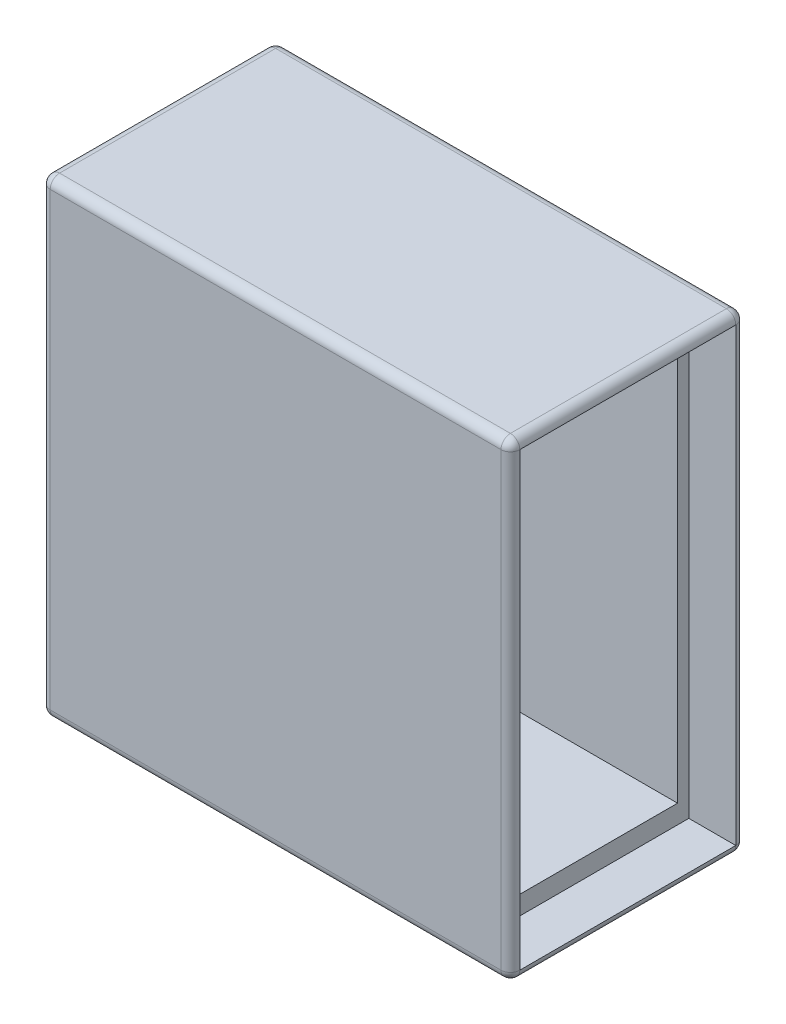
from build123d import *

# Parameters (mm, degrees)
SKETCH_1_W          = 50
SKETCH_1_H          = 50
EXTRUDE_1_DEPTH     = 25
SHELL_2_T           = 5
SKETCH_3_R          = 3.75
CUT_EXTRUDE_3_DEPTH = 17.5
FILLET_2_R          = 1
SKETCH_8_W          = 23
SKETCH_8_H          = 48
CUT_EXTRUDE_5_DEPTH = 5
SKETCH_2_R          = 3.125
CUT_EXTRUDE_6_DEPTH = 10
SKETCH_9_W          = 20.6
SKETCH_9_H          = 44
SKETCH_9_W_2        = 15
SKETCH_9_H_2        = 40
CUT_EXTRUDE_7_DEPTH = 40


with BuildPart() as part:
    # 草图1 → 凸台-拉伸1 (new body)
    with BuildSketch(Plane.XY):
        with Locations((25, 25)):
            Rectangle(SKETCH_1_W, SKETCH_1_H)
    extrude(amount=-EXTRUDE_1_DEPTH)

    # 抽壳2 (no face opened: a closed hollow body)
    add(offset(amount=-SHELL_2_T, mode=Mode.PRIVATE), mode=Mode.SUBTRACT)

    # 草图3 → 切除-拉伸3 (cut)
    with BuildSketch(Plane.ZY):
        with Locations((-12.488340482, 40.625)):
            Circle(SKETCH_3_R)
    extrude(amount=-CUT_EXTRUDE_3_DEPTH, mode=Mode.SUBTRACT)

    # 圆角2
    fillet_2_edges = [part.edges().sort_by_distance(p)[0] for p in [
        (50, 25, -25),
        (25, 50, -25),
        (0, 25, -25),
        (25, 50, 0),
        (50, 25, 0),
        (25, 0, 0),
        (0, 25, 0),
        (0, 50, -12.5),
        (50, 50, -12.5),
        (50, 0, -12.5),
        (0, 0, -12.5),
        (25, 0, -25),
    ]]
    fillet(fillet_2_edges, radius=FILLET_2_R)

    # 草图8 → 切除-拉伸5 (cut)
    with BuildSketch(Plane(origin=(50, 0, 0), x_dir=(0, 0, -1), z_dir=(1, 0, 0))):
        with Locations((12.5, 25)):
            Rectangle(SKETCH_8_W, SKETCH_8_H)
    extrude(amount=-CUT_EXTRUDE_5_DEPTH, mode=Mode.SUBTRACT)

    # 草图2 → 切除-拉伸6 (cut)
    with BuildSketch(Plane.ZY):
        with Locations((-19.5, 18.625)):
            Circle(SKETCH_2_R)
        with Locations((-19.5, 28)):
            Circle(SKETCH_2_R)
        with Locations((-5.5, 28)):
            Circle(SKETCH_2_R)
        with Locations((-5.5, 18.625)):
            Circle(SKETCH_2_R)
        with Locations((-12.5, 8.125)):
            Circle(SKETCH_2_R)
    extrude(amount=-CUT_EXTRUDE_6_DEPTH, mode=Mode.SUBTRACT)

    # 草图9 → 切除-拉伸7 (cut)
    with BuildSketch(Plane(origin=(45, 0, 0), x_dir=(0, 0, -1), z_dir=(1, 0, 0))):
        with Locations((12.5, 25)):
            Rectangle(SKETCH_9_W, SKETCH_9_H)
        with Locations((12.5, 25)):
            Rectangle(SKETCH_9_W_2, SKETCH_9_H_2, mode=Mode.SUBTRACT)
    extrude(amount=-CUT_EXTRUDE_7_DEPTH, mode=Mode.SUBTRACT)


solid = part.part
